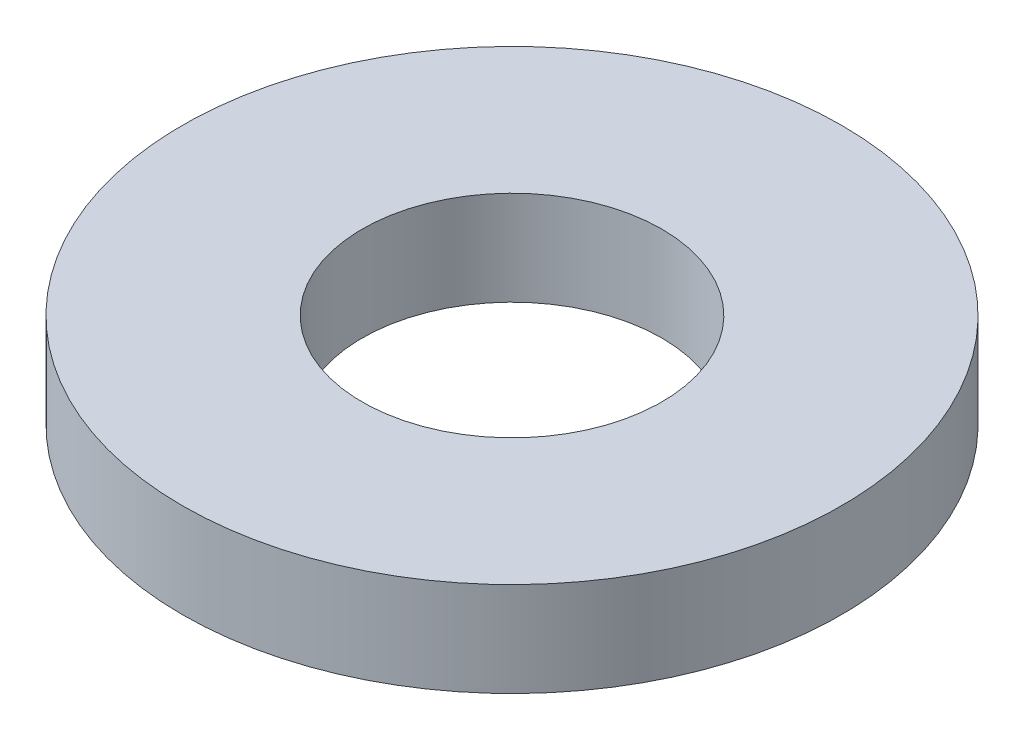
from build123d import *

# Parameters (mm, degrees)
SKETCH1_W = 3.048
SKETCH1_H = 1.6002


with BuildPart() as part:
    # Sketch1 → Revolve1 (revolve)
    with BuildSketch(Plane.XY, mode=Mode.PRIVATE) as revolve1_sk:
        with Locations((4.064, 0.8001)):
            Rectangle(SKETCH1_W, SKETCH1_H)
    revolve(revolve1_sk.sketch.rotate(Axis((0, 0, 0), (0, 1, 0)), 90), axis=Axis((0, 0, 0), (0, 1, 0)))


solid = part.part
